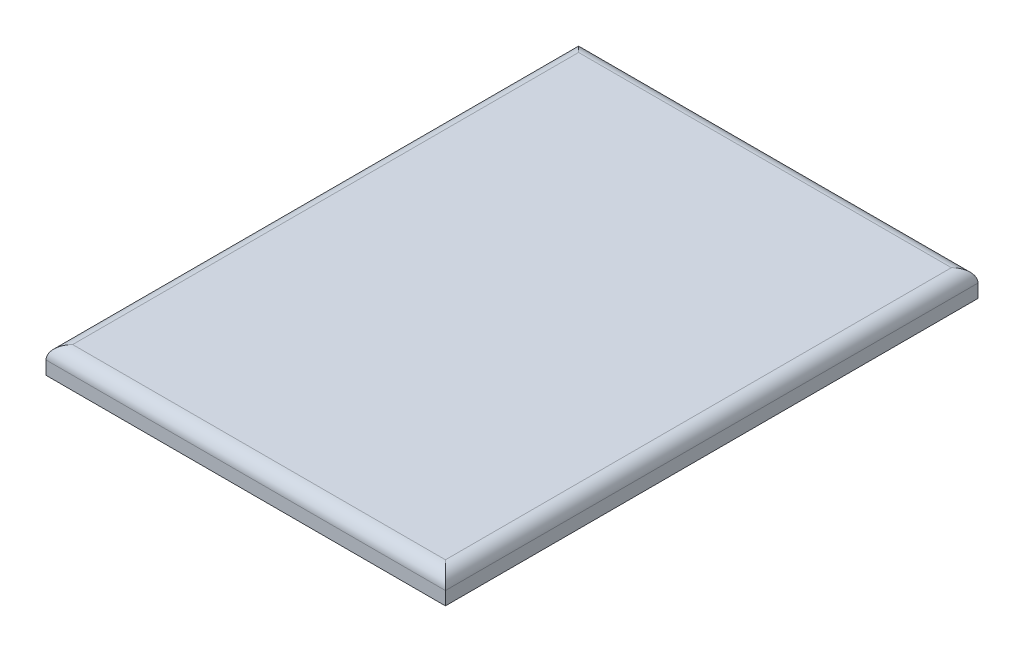
from build123d import *

# Parameters (mm, degrees)
SKETCH1_W           = 15
SKETCH1_H           = 20
BOSS_EXTRUDE1_DEPTH = 1
FILLET1_R           = 0.5


with BuildPart() as part:
    # Sketch1 → Boss-Extrude1 (new body)
    with BuildSketch(Plane(origin=(0, 0, 0), x_dir=(1, 0, 0), z_dir=(0, 1, 0))):
        with Locations((9.27852349, 1.375838926)):
            Rectangle(SKETCH1_W, SKETCH1_H)
    extrude(amount=BOSS_EXTRUDE1_DEPTH)

    # Fillet1
    fillet1_edges = [part.edges().sort_by_distance(p)[0] for p in [
        (16.77852349, 1, -1.375838926),
        (9.27852349, 1, -11.375838926),
        (1.77852349, 1, -1.375838926),
        (9.27852349, 1, 8.624161074),
    ]]
    fillet(fillet1_edges, radius=FILLET1_R)


solid = part.part
